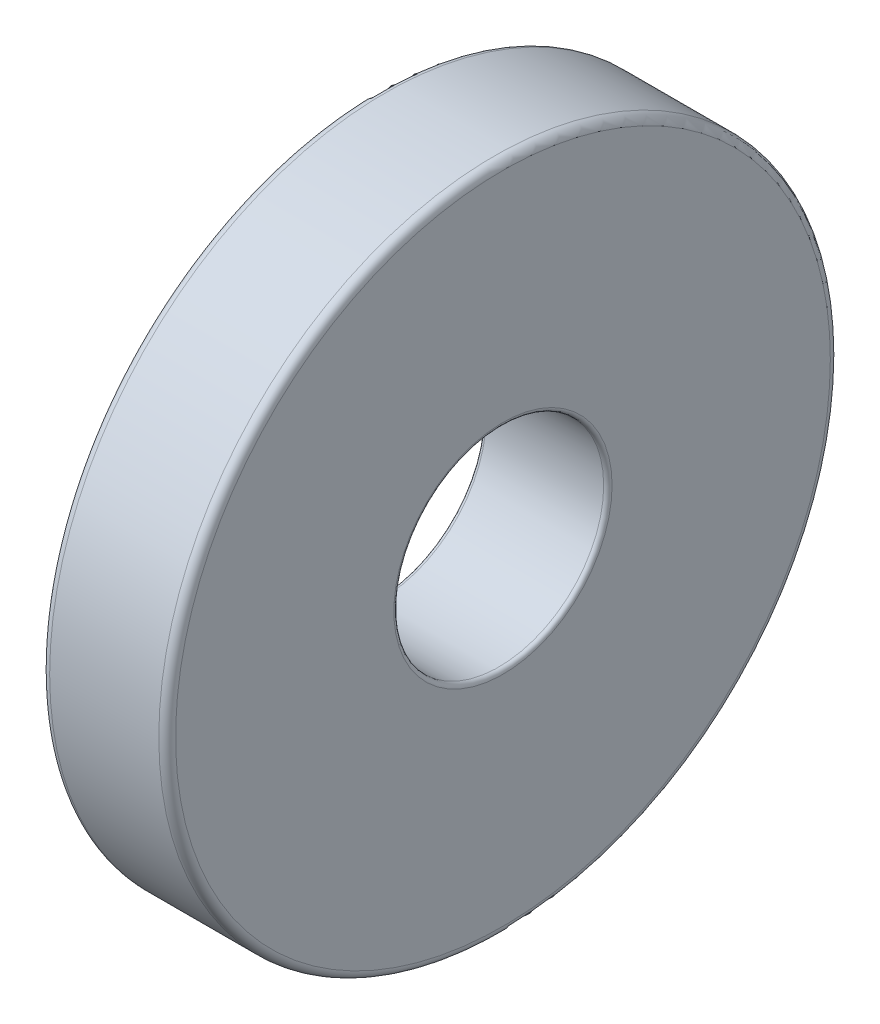
from build123d import *

# Parameters (mm, degrees)
SKETCH1_R           = 80
SKETCH1_R_2         = 25
BOSS_EXTRUDE1_DEPTH = 30
FILLET2_R           = 2
FILLET3_R           = 1


with BuildPart() as part:
    # Sketch1 → Boss-Extrude1 (new body)
    with BuildSketch(Plane(origin=(0, 0, 0), x_dir=(0, 0, -1), z_dir=(1, 0, 0))):
        Circle(SKETCH1_R)
        Circle(SKETCH1_R_2, mode=Mode.SUBTRACT)
    extrude(amount=BOSS_EXTRUDE1_DEPTH)

    # Fillet2
    fillet2_edges = [part.edges().sort_by_distance(p)[0] for p in [
        (0, 0, 80),
        (30, 0, 80),
    ]]
    fillet(fillet2_edges, radius=FILLET2_R)

    # Fillet3
    fillet3_edges = [part.edges().sort_by_distance(p)[0] for p in [
        (0, 0, 25),
        (30, 0, 25),
    ]]
    fillet(fillet3_edges, radius=FILLET3_R)


solid = part.part
